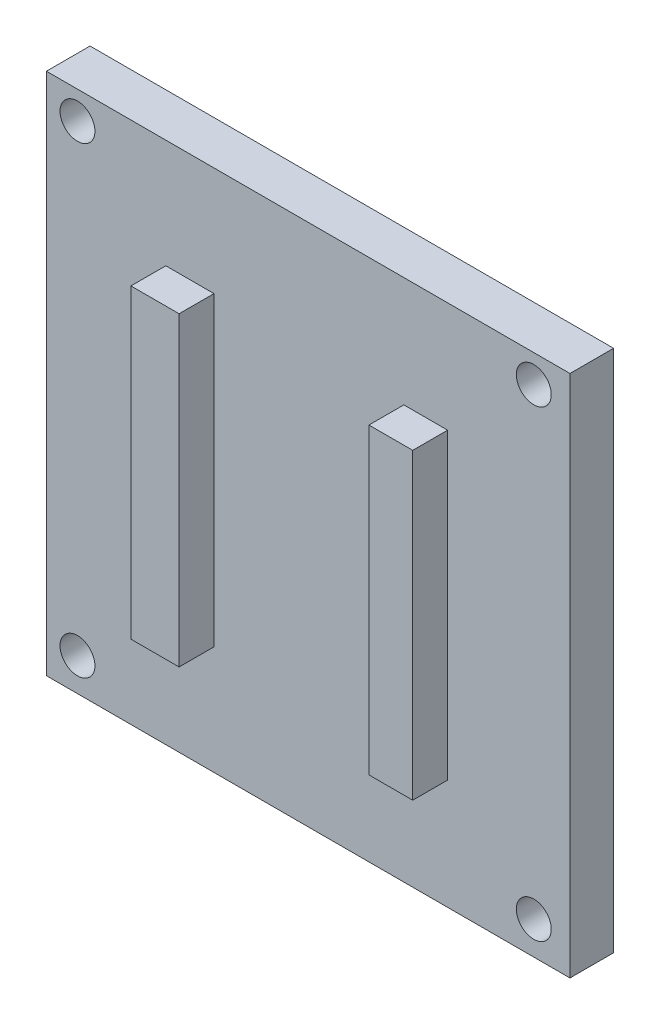
from build123d import *

# Parameters (mm, degrees)
SKETCH1_W           = 60
SKETCH1_H           = 60
BOSS_EXTRUDE1_DEPTH = 5
SKETCH2_R           = 2
CUT_EXTRUDE1_DEPTH  = 43.720018727
SKETCH5_R           = 2
CUT_EXTRUDE2_DEPTH  = 43.720018727
SKETCH6_R           = 2
CUT_EXTRUDE3_DEPTH  = 43.720018727
SKETCH7_R           = 2
CUT_EXTRUDE4_DEPTH  = 43.720018727
SKETCH8_W           = 5.522489043
SKETCH8_H           = 35.05943801
BOSS_EXTRUDE2_DEPTH = 4
SKETCH11_W          = 5.020444584
SKETCH11_H          = 34.724741706
BOSS_EXTRUDE3_DEPTH = 4


with BuildPart() as part:
    # Sketch1 → Boss-Extrude1 (new body)
    with BuildSketch(Plane.XY):
        Rectangle(SKETCH1_W, SKETCH1_H)
    extrude(amount=-BOSS_EXTRUDE1_DEPTH)

    # Sketch2 → Cut-Extrude1 (cut, through all)
    with BuildSketch(Plane.XY):
        with Locations((-26.441008142, 26.817541486)):
            Circle(SKETCH2_R)
    extrude(amount=-CUT_EXTRUDE1_DEPTH, mode=Mode.SUBTRACT)

    # Sketch5 → Cut-Extrude2 (cut, through all)
    with BuildSketch(Plane.XY):
        with Locations((-26.441008142, -26.231822951)):
            Circle(SKETCH5_R)
    extrude(amount=-CUT_EXTRUDE2_DEPTH, mode=Mode.SUBTRACT)

    # Sketch6 → Cut-Extrude3 (cut, through all)
    with BuildSketch(Plane.XY):
        with Locations((25.855289607, 26.817541486)):
            Circle(SKETCH6_R)
    extrude(amount=-CUT_EXTRUDE3_DEPTH, mode=Mode.SUBTRACT)

    # Sketch7 → Cut-Extrude4 (cut, through all)
    with BuildSketch(Plane.XY):
        with Locations((25.855289607, -26.231822951)):
            Circle(SKETCH7_R)
    extrude(amount=-CUT_EXTRUDE4_DEPTH, mode=Mode.SUBTRACT)

    # Sketch8 → Boss-Extrude2 (add)
    with BuildSketch(Plane.XY):
        with Locations((-13.555200377, 0)):
            Rectangle(SKETCH8_W, SKETCH8_H)
    extrude(amount=BOSS_EXTRUDE2_DEPTH)

    # Sketch11 → Boss-Extrude3 (add)
    with BuildSketch(Plane.XY):
        with Locations((13.4715263, 0)):
            Rectangle(SKETCH11_W, SKETCH11_H)
    extrude(amount=BOSS_EXTRUDE3_DEPTH)


solid = part.part
